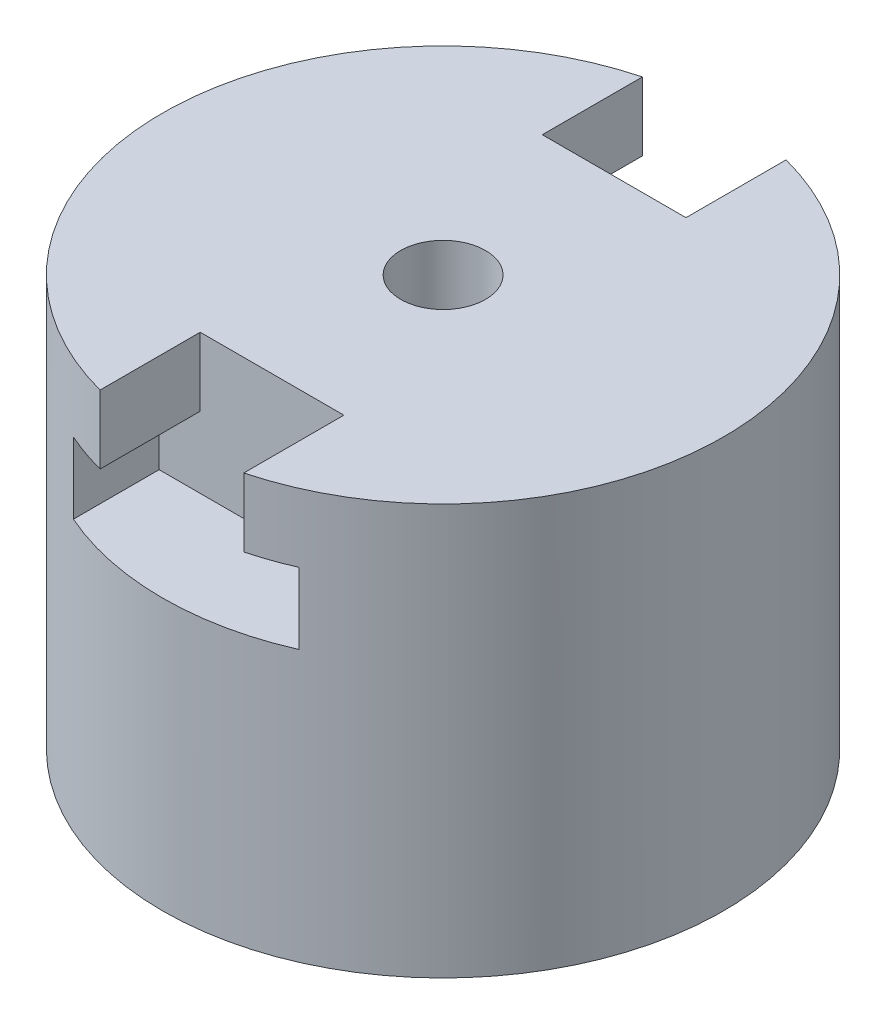
from build123d import *

# Parameters (mm, degrees)
SKETCH2_R           = 20.5
BOSS_EXTRUDE2_DEPTH = 30
SKETCH4_R           = 15.5
SKETCH4_R_2         = 12
CUT_EXTRUDE2_DEPTH  = 5
SKETCH6_R           = 3.1
CUT_EXTRUDE3_DEPTH  = 35.419562394
CUT_EXTRUDE4_DEPTH  = 8
CUT_EXTRUDE6_DEPTH  = 8


with BuildPart() as part:
    # Sketch2 → Boss-Extrude2 (new body)
    with BuildSketch(Plane(origin=(0, 0, 0), x_dir=(1, 0, 0), z_dir=(0, 1, 0))):
        with Locations(Location((0, 0, 0), (0, 0, 270))):
            Circle(SKETCH2_R)
    extrude(amount=BOSS_EXTRUDE2_DEPTH)

    # Sketch4 → Cut-Extrude2 (cut)
    with BuildSketch(Plane.XZ):
        with Locations(Location((0, 0, 0), (0, 0, 270))):
            Circle(SKETCH4_R)
        with Locations(Location((0, 0, 0), (0, 0, 270))):
            Circle(SKETCH4_R_2, mode=Mode.SUBTRACT)
    extrude(amount=-CUT_EXTRUDE2_DEPTH, mode=Mode.SUBTRACT)

    # Sketch5 → Cut-Revolve1 (revolve, cut)
    with BuildSketch(Plane.XY, mode=Mode.PRIVATE) as cut_revolve1_sk:
        Polygon((0, 0), (0, 11.447203031), (3.1, 11.447203031), (11.5, 0), align=None)
    revolve(cut_revolve1_sk.sketch.rotate(Axis((0, 0, 0), (0, 1, 0)), 90), axis=Axis((0, 0, 0), (0, 1, 0)), mode=Mode.SUBTRACT)

    # Sketch6 → Cut-Extrude3 (cut, through all)
    with BuildSketch(Plane.XZ.offset(-11.447203031)):
        with Locations(Location((0, 0, 0), (0, 0, 270))):
            Circle(SKETCH6_R)
    extrude(amount=-CUT_EXTRUDE3_DEPTH, mode=Mode.SUBTRACT)

    # Sketch8 → Cut-Extrude4 (cut)
    with BuildSketch(Plane.XY.offset(20.5)):
        Polygon((-5.25, 30), (5.25, 30), (5.25, 25), (8.25, 25), (8.25, 19.8), (-8.25, 19.8), (-8.25, 25), (-5.25, 25), align=None)
    extrude(amount=-CUT_EXTRUDE4_DEPTH, mode=Mode.SUBTRACT)

    # Sketch9 → Cut-Extrude6 (cut)
    with BuildSketch(Plane.XY.offset(-20.5)):
        Polygon((5.25, 30), (-5.25, 30), (-5.25, 25), (-8.25, 25), (-8.25, 19.8), (8.25, 19.8), (8.25, 25), (5.25, 25), align=None)
    extrude(amount=CUT_EXTRUDE6_DEPTH, mode=Mode.SUBTRACT)


solid = part.part
